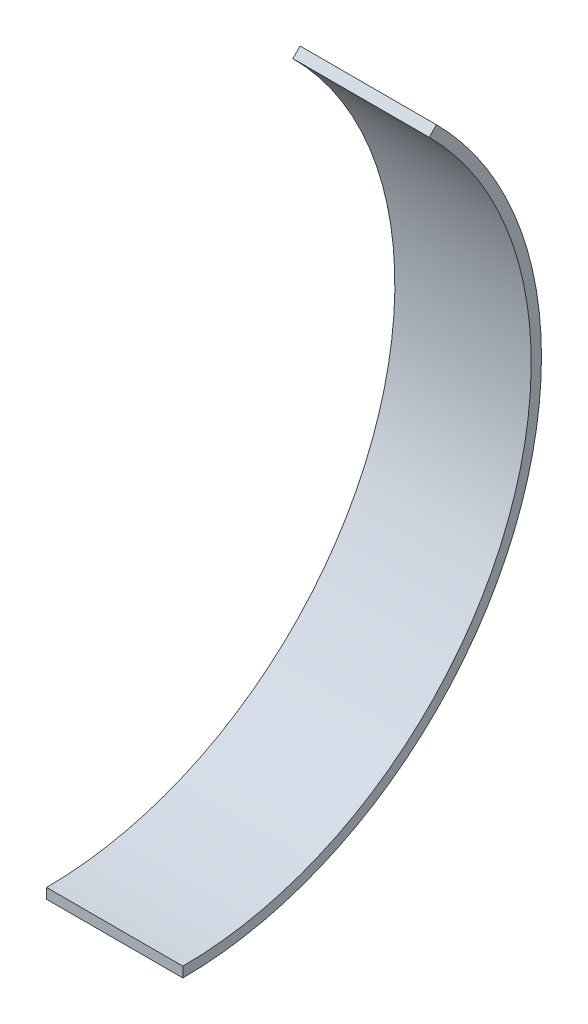
from build123d import *

# Parameters (mm, degrees)
SKETCH1_W           = 43.841999946
SKETCH1_H           = 3.302
REVOLVE_THIN1_ANGLE = 135


with BuildPart() as part:
    # Sketch1 → Revolve-Thin1 (revolve)
    with BuildSketch(Plane.XY):
        with Locations((21.920999973, -1.651)):
            Rectangle(SKETCH1_W, SKETCH1_H)
    revolve(axis=Axis((0, 112.014, 0), (1, 0, 0)), revolution_arc=REVOLVE_THIN1_ANGLE)


solid = part.part
